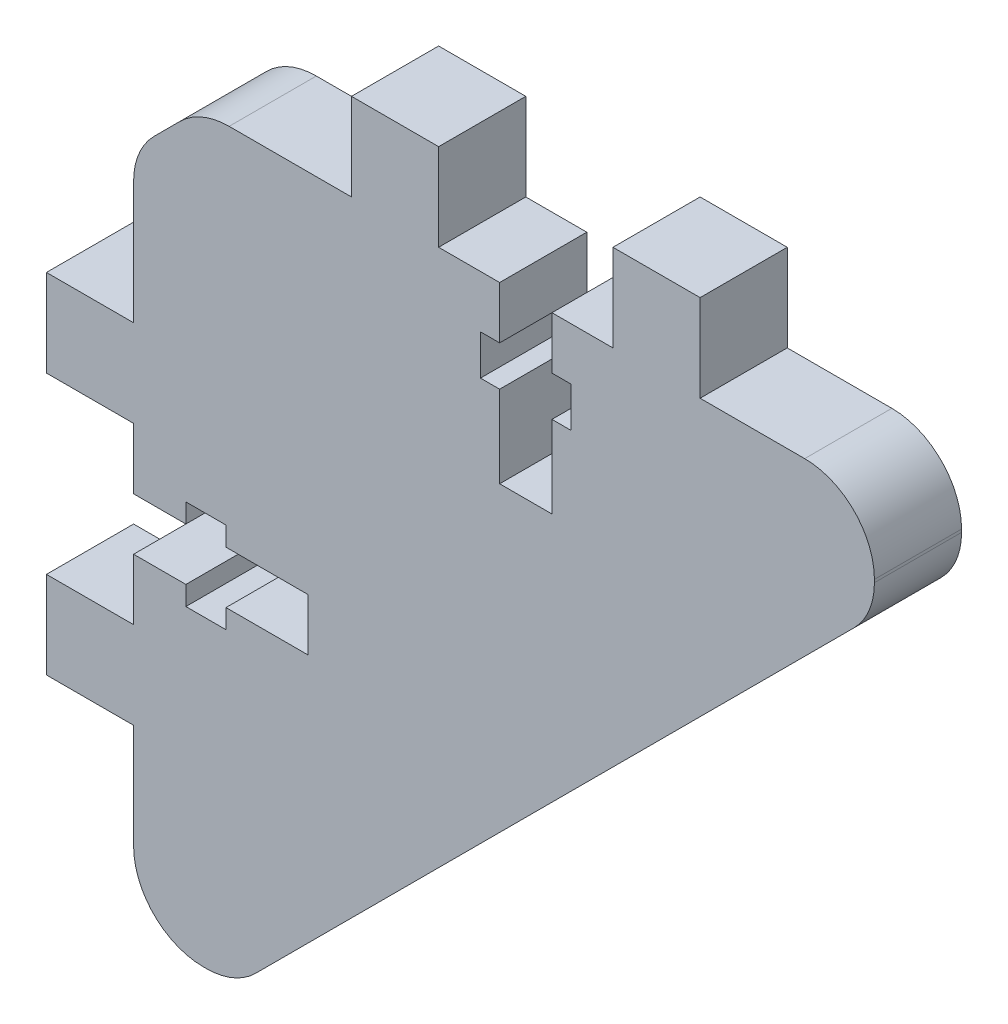
from build123d import *

# Parameters (mm, degrees)
SKETCH1_W           = 5
SKETCH1_H           = 5
BOSS_EXTRUDE1_DEPTH = 5


with BuildPart() as part:
    # Sketch1 → Boss-Extrude1 (new body)
    with BuildSketch(Plane.XY):
        with BuildLine():
            Line((17.5, -5), (10.481741735, -5))
            ThreePointArc((10.481741735, -5), (8.951008006, -5.30448187), (7.653314611, -6.171572875))
            Line((7.653314611, -6.171572875), (6.171572875, -7.653314611))
            ThreePointArc((6.171572875, -7.653314611), (5.30448187, -8.951008006), (5, -10.481741735))
            Line((5, -10.481741735), (5, -17.5))
            Line((5, -17.5), (5, -22.5))
            Line((5, -22.5), (5, -26))
            Line((5, -26), (8, -26))
            Line((8, -26), (8, -24.9))
            Line((8, -24.9), (10.3, -24.9))
            Line((10.3, -24.9), (10.3, -26))
            Line((10.3, -26), (15, -26))
            Line((15, -26), (15, -29))
            Line((15, -29), (10.3, -29))
            Line((10.3, -29), (10.3, -30.1))
            Line((10.3, -30.1), (8, -30.1))
            Line((8, -30.1), (8, -29))
            Line((8, -29), (5, -29))
            Line((5, -29), (5, -32.5))
            Line((5, -32.5), (5, -37.5))
            Line((5, -37.5), (5, -43.5))
            ThreePointArc((5, -43.5), (6.171572875, -46.328427125), (9, -47.5))
            Line((9, -47.5), (9.165507919, -47.5))
            ThreePointArc((9.165507919, -47.5), (10.696241649, -47.19551813), (11.993935044, -46.328427125))
            Line((11.993935044, -46.328427125), (46.328427125, -11.993935044))
            ThreePointArc((46.328427125, -11.993935044), (47.19551813, -10.696241649), (47.5, -9.165507919))
            Line((47.5, -9.165507919), (47.5, -9))
            ThreePointArc((47.5, -9), (46.328427125, -6.171572875), (43.5, -5))
            Line((43.5, -5), (37.5, -5))
            Line((37.5, -5), (32.5, -5))
            Line((32.5, -5), (29, -5))
            Line((29, -5), (29, -8))
            Line((29, -8), (30.1, -8))
            Line((30.1, -8), (30.1, -10.3))
            Line((30.1, -10.3), (29, -10.3))
            Line((29, -10.3), (29, -15))
            Line((29, -15), (26, -15))
            Line((26, -15), (26, -10.3))
            Line((26, -10.3), (24.9, -10.3))
            Line((24.9, -10.3), (24.9, -8))
            Line((24.9, -8), (26, -8))
            Line((26, -8), (26, -5))
            Line((26, -5), (22.5, -5))
            Line((22.5, -5), (17.5, -5))
        make_face()
        with Locations((2.5, -20)):
            Rectangle(SKETCH1_W, SKETCH1_H)
        with Locations((20, -2.5)):
            Rectangle(SKETCH1_W, SKETCH1_H)
        with Locations((35, -2.5)):
            Rectangle(SKETCH1_W, SKETCH1_H)
        with Locations((2.5, -35)):
            Rectangle(SKETCH1_W, SKETCH1_H)
    extrude(amount=BOSS_EXTRUDE1_DEPTH)


solid = part.part
